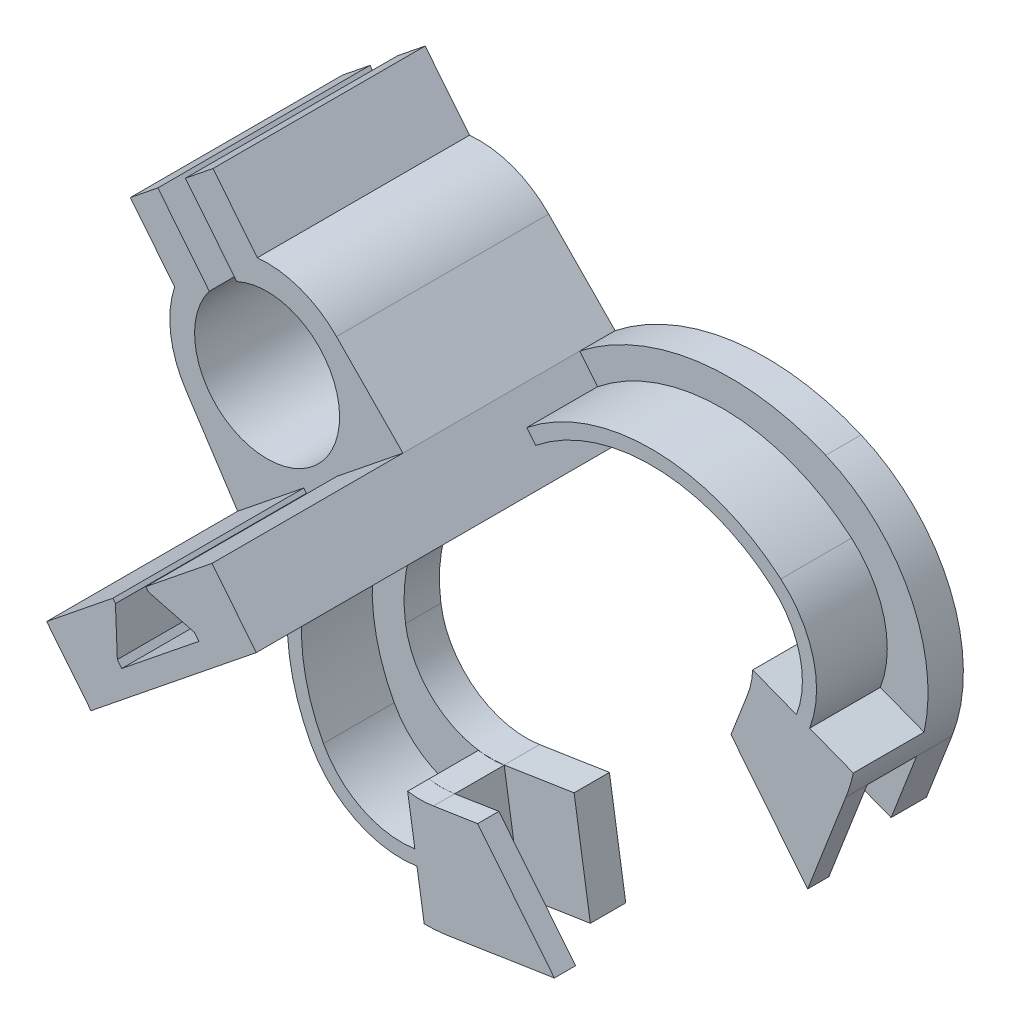
from build123d import *

# Parameters (mm, degrees)
ESTRUSIONE_ESTRUSIONE1_DEPTH = 5
ESTRUSIONE_ESTRUSIONE2_DEPTH = 7
ESTRUSIONE_ESTRUSIONE3_DEPTH = 3
ESTRUSIONE_ESTRUSIONE4_DEPTH = 52
TAGLIO_ESTRUSIONE2_DEPTH     = 27
ESTRUSIONE_ESTRUSIONE8_DEPTH = 10
ESTRUSIONE_ESTRUSIONE6_DEPTH = 30
SCHIZZO10_W                  = 14
SCHIZZO10_H                  = 7
ESTRUSIONE_ESTRUSIONE7_DEPTH = 0.3


with BuildPart() as part:
    # Schizzo1 → Estrusione-Estrusione1 (new body)
    with BuildSketch(Plane.XY):
        with BuildLine():
            Line((-82.995904107, -166.584374689), (-92.877799089, -168.116742646))
            ThreePointArc((-92.877799089, -168.116742646), (-110.220012955, -164.040092202), (-119.840608042, -149.046239769))
            ThreePointArc((-119.840608042, -149.046239769), (-118.364815633, -130.917411526), (-107.867932944, -116.063192243))
            Line((-107.867932944, -116.063192243), (-84.49215827, -97.259651129))
            ThreePointArc((-84.49215827, -97.259651129), (-67.733683115, -90.189581316), (-49.709718148, -92.632748029))
            ThreePointArc((-49.709718148, -92.632748029), (-37.125664022, -105.242785395), (-36.859828578, -123.055724291))
            Line((-36.859828578, -123.055724291), (-40.474113425, -132.379722631))
            Line((-40.474113425, -132.379722631), (-54.467826156, -126.955304689))
            Line((-54.467826156, -126.955304689), (-50.853541308, -117.631306349))
            ThreePointArc((-50.853541308, -117.631306349), (-51.095893898, -108.22813541), (-57.953355129, -101.789689638))
            ThreePointArc((-57.953355129, -101.789689638), (-68.520842721, -100.735914417), (-78.224311232, -105.051576021))
            Line((-78.224311232, -105.051576021), (-101.600085906, -123.855117134))
            ThreePointArc((-101.600085906, -123.855117134), (-107.894780127, -132.408424149), (-109.129903142, -142.956253658))
            ThreePointArc((-109.129903142, -142.956253658), (-104.310440062, -151.034071069), (-95.177618995, -153.285723315))
            Line((-95.177618995, -153.285723315), (-85.295724012, -151.753355358))
            Line((-85.295724012, -151.753355358), (-82.995904107, -166.584374689))
        make_face()
    extrude(amount=ESTRUSIONE_ESTRUSIONE1_DEPTH)

    # Schizzo2 → Estrusione-Estrusione2 (add)
    with BuildSketch(Plane.XY.offset(5)):
        with BuildLine():
            Line((-36.859828578, -123.055724291), (-50.830842779, -117.640105037))
            ThreePointArc((-50.830842779, -117.640105037), (-50.298673229, -115.886666013), (-50.034997321, -114.073318872))
            Line((-50.034997321, -114.073318872), (-35.811832194, -119.586680021))
            ThreePointArc((-35.811832194, -119.586680021), (-36.269524014, -121.341233275), (-36.859828578, -123.055724291))
        make_face()
        with BuildLine():
            Line((-96.490830562, -168.397042736), (-98.828360202, -153.322841843))
            ThreePointArc((-98.828360202, -153.322841843), (-97.000632762, -153.453858051), (-95.173888567, -153.309779998))
            Line((-95.173888567, -153.309779998), (-92.877799089, -168.116742646))
            ThreePointArc((-92.877799089, -168.116742646), (-94.678957246, -168.325951195), (-96.490830562, -168.397042736))
        make_face()
    extrude(amount=ESTRUSIONE_ESTRUSIONE2_DEPTH)

    # Schizzo3 → Estrusione-Estrusione3 (add)
    with BuildSketch(Plane.XY.offset(12)):
        with BuildLine():
            Line((-42.270578454, -137.014176653), (-36.859828578, -123.055724291))
            ThreePointArc((-36.859828578, -123.055724291), (-36.269524014, -121.341233275), (-35.811832194, -119.586680021))
            Line((-35.811832194, -119.586680021), (-50.034997321, -114.073318872))
            ThreePointArc((-50.034997321, -114.073318872), (-50.288758238, -115.888878313), (-50.830842779, -117.640105037))
            Line((-50.830842779, -117.640105037), (-53.115040991, -123.532795079))
            Line((-53.115040991, -123.532795079), (-42.270578454, -137.014176653))
        make_face()
        with BuildLine():
            Line((-96.490830562, -168.397042736), (-98.828360202, -153.322841843))
            ThreePointArc((-98.828360202, -153.322841843), (-97.000596453, -153.464016791), (-95.173888567, -153.309779998))
            Line((-95.173888567, -153.309779998), (-88.928612449, -152.34133609))
            Line((-88.928612449, -152.34133609), (-78.084149913, -165.822717664))
            Line((-78.084149913, -165.822717664), (-92.877799089, -168.116742646))
            ThreePointArc((-92.877799089, -168.116742646), (-94.678957246, -168.325951195), (-96.490830562, -168.397042736))
        make_face()
    extrude(amount=ESTRUSIONE_ESTRUSIONE3_DEPTH)

    # Schizzo4 → Estrusione-Estrusione4 (add)
    with BuildSketch(Plane.XY.offset(5)):
        Polygon((-101.600085906, -123.855117134), (-78.224311232, -105.051576021), (-84.49215827, -97.259651129), (-107.867932944, -116.063192243), align=None)
    extrude(amount=ESTRUSIONE_ESTRUSIONE4_DEPTH)

    # Schizzo5 → Taglio-Estrusione2 (cut)
    with BuildSketch(Plane.XY.offset(57)):
        Polygon((-97.246900104, -116.503262037), (-97.873684808, -115.724069548), (-98.141552252, -109.009291291), (-98.517623074, -108.541775798), (-93.842468139, -104.781067575), (-93.466397317, -105.248583068), (-86.96498996, -106.949083694), (-86.338205256, -107.728276184), align=None)
    extrude(amount=-TAGLIO_ESTRUSIONE2_DEPTH, mode=Mode.SUBTRACT)

    # Schizzo6 → Estrusione-Estrusione8 (add)
    with BuildSketch(Plane.XY.offset(5)):
        Polygon((-97.823256998, -159.87152255), (-97.519846298, -161.848374074), (-97.50663255, -161.846365055), (-97.813109395, -159.869965078), align=None)
        with BuildLine():
            Line((-104.107224721, -120.738347178), (-105.360794128, -119.1799622))
            ThreePointArc((-105.360794128, -119.1799622), (-115.28727508, -135.493487076), (-112.492970749, -154.384172115))
            ThreePointArc((-112.492970749, -154.384172115), (-106.191101066, -160.49275607), (-97.519846298, -161.848374074))
            Line((-97.519846298, -161.848374074), (-97.823256998, -159.87152255))
            ThreePointArc((-97.823256998, -159.87152255), (-105.298812913, -158.702833766), (-110.731703589, -153.436576214))
            ThreePointArc((-110.731703589, -153.436576214), (-113.327097811, -135.89060806), (-104.107224721, -120.738347178))
        make_face()
        with BuildLine():
            ThreePointArc((-43.853805634, -116.458338954), (-43.393471858, -108.905997429), (-47.373234104, -102.470839142))
            ThreePointArc((-47.373234104, -102.470839142), (-63.955496248, -96.175948212), (-80.731450047, -101.934806064))
            Line((-80.731450047, -101.934806064), (-81.985019455, -100.376421086))
            ThreePointArc((-81.985019455, -100.376421086), (-63.923362402, -94.176206375), (-46.070241465, -100.953535552))
            ThreePointArc((-46.070241465, -100.953535552), (-41.453924934, -108.417983362), (-41.987888093, -117.178305432))
            Line((-41.987888093, -117.178305432), (-43.853805634, -116.458338954))
        make_face()
        Polygon((-43.857501376, -116.467917109), (-43.853805634, -116.458338954), (-41.987888093, -117.178305432), (-41.99269947, -117.190774947), align=None)
    extrude(amount=ESTRUSIONE_ESTRUSIONE8_DEPTH)

    # Schizzo9 → Estrusione-Estrusione6 (add)
    with BuildSketch(Plane(origin=(0, 0, 0), x_dir=(-1, 0, 0), z_dir=(0, 0, -1))):
        with BuildLine():
            Line((93.885019226, -87.68303048), (84.49215827, -97.259651129))
            Line((84.49215827, -97.259651129), (107.867932944, -116.063192243))
            Line((107.867932944, -116.063192243), (115.209386763, -104.836413728))
            ThreePointArc((115.209386763, -104.836413728), (117.333034353, -99.111871829), (116.768742523, -93.032247353))
            Line((116.768742523, -93.032247353), (123.036589561, -85.240322461))
            Line((123.036589561, -85.240322461), (119.140627115, -82.106398942))
            Line((119.140627115, -82.106398942), (111.879963827, -91.132551409))
            ThreePointArc((111.879963827, -91.132551409), (97.276918838, -105.29783483), (107.984001382, -87.99862789))
            Line((107.984001382, -87.99862789), (115.24466467, -78.972475424))
            Line((115.24466467, -78.972475424), (111.348702224, -75.838551905))
            Line((111.348702224, -75.838551905), (105.080855186, -83.630476796))
            ThreePointArc((105.080855186, -83.630476796), (99.021531527, -84.382045715), (93.885019226, -87.68303048))
        make_face()
    extrude(amount=-ESTRUSIONE_ESTRUSIONE6_DEPTH)

    # Schizzo10 → Estrusione-Estrusione7 (add)
    with BuildSketch(Plane(origin=(18.694228144, -23.239881369, 0), x_dir=(0.779192489117125, 0.6267847037886766, 0), z_dir=(-0.6267847037886766, 0.779192489117125, 0))):
        with Locations((-141.796516737, -33.5)):
            Rectangle(SCHIZZO10_W, SCHIZZO10_H)
    extrude(amount=ESTRUSIONE_ESTRUSIONE7_DEPTH)


solid = part.part
